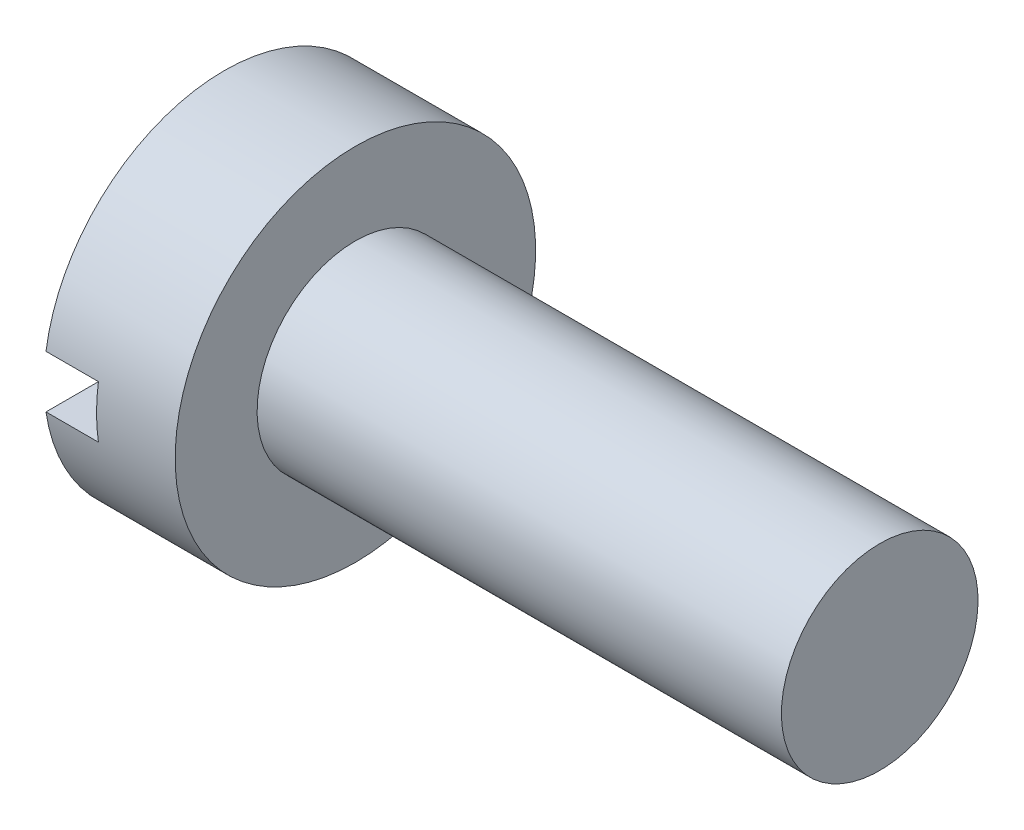
from build123d import *

# Parameters (mm, degrees)
SKETCH2_W          = 5.5
SKETCH2_H          = 0.8
CUT_EXTRUDE1_DEPTH = 0.8


with BuildPart() as part:
    # Sketch1 → Revolve1 (revolve)
    with BuildSketch(Plane.XY):
        Polygon((0, 0), (0, 2.75), (2, 2.75), (2, 1.5), (10, 1.5), (10, 0), align=None)
    revolve(axis=Axis((10, 0, 0), (-1, 0, 0)))

    # Sketch2 → Cut-Extrude1 (cut)
    with BuildSketch(Plane.ZY):
        Rectangle(SKETCH2_W, SKETCH2_H)
    extrude(amount=-CUT_EXTRUDE1_DEPTH, mode=Mode.SUBTRACT)


solid = part.part
